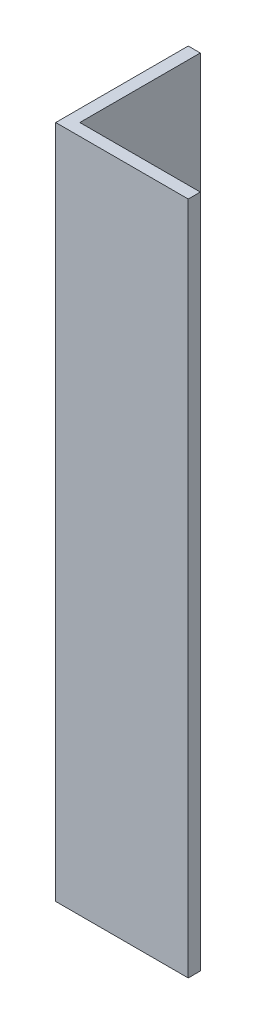
from build123d import *

# Parameters (mm, degrees)
EXTRUDE_1_DEPTH = 112


with BuildPart() as part:
    # Эскиз1 → Вытянуть1 (new body)
    with BuildSketch(Plane(origin=(0, 0, 0), x_dir=(1, 0, 0), z_dir=(0, 1, 0))):
        Polygon((0, -1.071873395), (0, -21.071873395), (20, -21.071873395), (20, -23.071873395), (-2, -23.071873395), (-2, -1.071873395), align=None)
    extrude(amount=EXTRUDE_1_DEPTH)


solid = part.part
